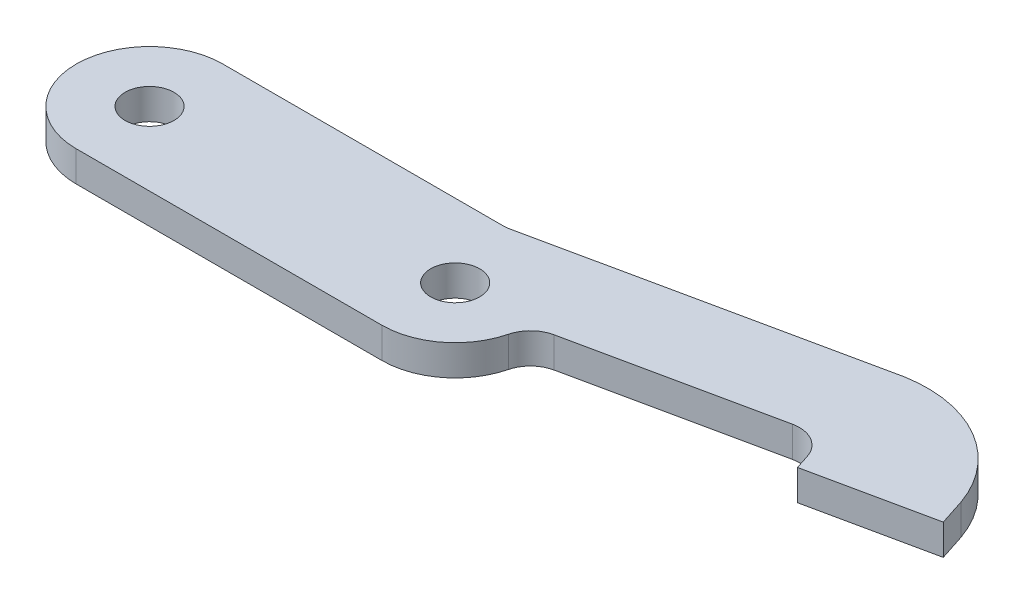
from build123d import *

# Parameters (mm, degrees)
SKETCH1_R           = 4
BOSS_EXTRUDE1_DEPTH = 5
FILLET1_R           = 5


with BuildPart() as part:
    # Sketch1 → Boss-Extrude1 (new body)
    with BuildSketch(Plane(origin=(0, 0, 0), x_dir=(1, 0, 0), z_dir=(0, 1, 0))):
        with BuildLine():
            Line((0, 12), (46.309546143, 12))
            Line((46.309546143, 12), (100.107664183, 23.435142995))
            ThreePointArc((100.107664183, 23.435142995), (113.686830565, 20.974303457), (122.439553034, 10.304751439))
            Line((122.439553034, 10.304751439), (123.826560512, 6.023839123))
            Line((123.826560512, 6.023839123), (104.157567187, 1.843065531))
            Line((104.157567187, 1.843065531), (102, 8.502262467))
            Line((102, 8.502262467), (62, 0))
            ThreePointArc((62, 0), (58.485281374, -8.485281374), (50, -12))
            Line((50, -12), (0, -12))
            ThreePointArc((0, -12), (-12, 0), (0, 12))
        make_face()
        with Locations(Location((0, 0, 0), (0, 0, 270))):
            Circle(SKETCH1_R, mode=Mode.SUBTRACT)
        with Locations(Location((50, 0, 0), (0, 0, 270))):
            Circle(SKETCH1_R, mode=Mode.SUBTRACT)
    extrude(amount=BOSS_EXTRUDE1_DEPTH)

    # Fillet1
    fillet1_edges = [part.edges().sort_by_distance(p)[0] for p in [
        (102, 2.5, -8.502262467),
        (62, 2.5, 0),
        (46.309546143, 2.5, -12),
    ]]
    fillet(fillet1_edges, radius=FILLET1_R)


solid = part.part
